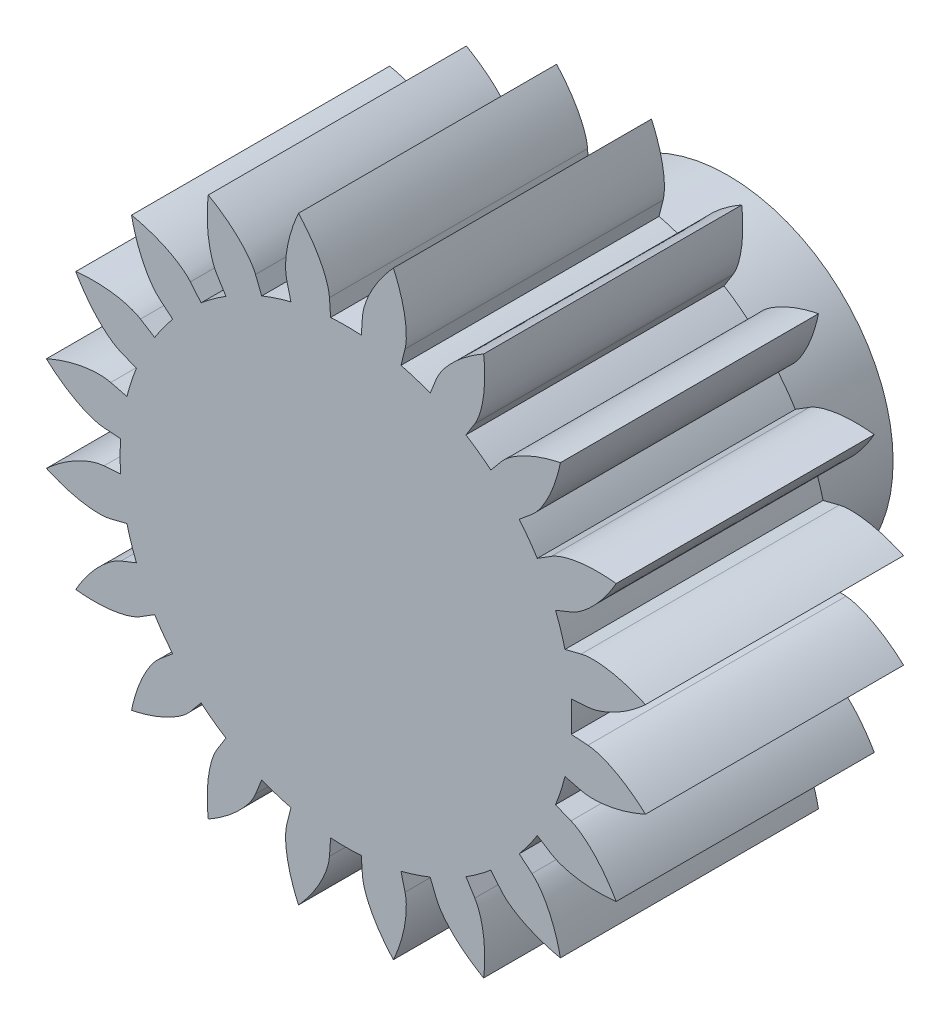
from build123d import *

# Parameters (mm, degrees)
SKETCH_1_R               = 5.5
SKETCH_1_R_2             = 1.475
EXTRUDE_1_DEPTH          = 5
EXTRUDE_START            = -5
SKETCH_6_R               = 6
SKETCH_6_R_2             = 5.5
EXTRUDE_4_DEPTH          = 5
CUT_EXTRUDE_1_DEPTH      = 10.848857802
PATTERN_CIRCULAR_1_COUNT = 20
PATTERN_CIRCULAR_1_ANGLE = 342
SKETCH_2_R               = 1.475
EXTRUDE_2_DEPTH          = 5
SKETCH_3_R               = 3.2
SKETCH_3_R_2             = 2.2
EXTRUDE_3_DEPTH          = 2.4
SKETCH_5_R               = 1.2
CUT_EXTRUDE_2_DEPTH      = 1


with BuildPart() as part:
    # 草图1 → 凸台-拉伸1 (new body)
    with BuildSketch(Plane.XY):
        Circle(SKETCH_1_R)
        Circle(SKETCH_1_R_2, mode=Mode.SUBTRACT)
    extrude(amount=EXTRUDE_1_DEPTH)

    # 草图6 → 凸台-拉伸4 (add)
    with BuildSketch(Plane.XY.offset(5).offset(EXTRUDE_START)):
        Circle(SKETCH_6_R)
        Circle(SKETCH_6_R_2, mode=Mode.SUBTRACT)
    extrude(amount=EXTRUDE_4_DEPTH)

    # 草图1<3> → 切除-拉伸1 (cut, through all)
    with BuildSketch(Plane.XY):
        with BuildLine():
            Line((4.68759624, 0.319369739), (4.364881259, 0.297382905))
            ThreePointArc((4.364881259, 0.297382905), (4.372469583, 0.148777503), (4.375, 0))
            ThreePointArc((4.375, 0), (4.372469583, -0.148777503), (4.364881259, -0.297382905))
            Line((4.364881259, -0.297382905), (4.68759624, -0.319369739))
            add(Edge.make_bspline(
                [(4.68759624, -0.319369739), (4.723328518, -0.321804208), (4.822539562, -0.336024472), (5.006239619, -0.392562489), (5.199142564, -0.482491423), (5.35109765, -0.572850293), (5.444197274, -0.635344688), (5.461765036, -0.647396861)],
                knots=[0, 0, 0, 0, 0, 0.005604068, 0.015718248, 0.029959916, 0.033300536, 0.033300536, 0.033300536, 0.033300536, 0.033300536], degree=4))
            ThreePointArc((5.461765036, -0.647396861), (5.490432938, -0.324262474), (5.5, 0))
            ThreePointArc((5.5, 0), (5.490432938, 0.324262474), (5.461765036, 0.647396861))
            add(Edge.make_bspline(
                [(4.68759624, 0.319369739), (4.723328518, 0.321804208), (4.822539562, 0.336024472), (5.006239619, 0.392562489), (5.199142564, 0.482491423), (5.35109765, 0.572850293), (5.444197274, 0.635344688), (5.461765036, 0.647396861)],
                knots=[0, 0, 0, 0, 0, 0.005604068, 0.015718248, 0.029959916, 0.033300536, 0.033300536, 0.033300536, 0.033300536, 0.033300536], degree=4))
        make_face()
        with BuildLine():
            add(Edge.make_bspline(
                [(5.461765036, 0.647396861), (5.542925307, 0.703075987), (5.660164645, 0.791829772), (5.771732758, 0.887518803), (5.877750133, 0.989088046), (5.912113353, 1.023188987)],
                knots=[0.033300536, 0.033300536, 0.033300536, 0.033300536, 0.033300536, 0.048733667, 0.056327564, 0.056327564, 0.056327564, 0.056327564, 0.056327564], degree=4))
            ThreePointArc((5.461765036, 0.647396861), (5.490432938, 0.324262474), (5.5, 0))
            ThreePointArc((5.5, 0), (5.490432938, -0.324262474), (5.461765036, -0.647396861))
            add(Edge.make_bspline(
                [(5.461765036, -0.647396861), (5.542925307, -0.703075987), (5.660164645, -0.791829772), (5.771732758, -0.887518803), (5.877750133, -0.989088046), (5.912113353, -1.023188987)],
                knots=[0.033300536, 0.033300536, 0.033300536, 0.033300536, 0.033300536, 0.048733667, 0.056327564, 0.056327564, 0.056327564, 0.056327564, 0.056327564], degree=4))
            ThreePointArc((5.912113353, -1.023188987), (5.977987961, -0.513478277), (6, 0))
            ThreePointArc((6, 0), (5.977987961, 0.513478277), (5.912113353, 1.023188987))
        make_face()
    cut_extrude_1 = extrude(amount=CUT_EXTRUDE_1_DEPTH, mode=Mode.SUBTRACT)

    # 阵列(圆周)1: 切除-拉伸1 ×20 about axis
    pattern_circular_1_axis = Axis((0, 0, 5), (0, 0, -1))
    for i in range(1, PATTERN_CIRCULAR_1_COUNT):
        add(cut_extrude_1.rotate(pattern_circular_1_axis, i * PATTERN_CIRCULAR_1_ANGLE / (PATTERN_CIRCULAR_1_COUNT - 1)), mode=Mode.SUBTRACT)

    # 草图2 → 凸台-拉伸2 (add, through all)
    with BuildSketch(Plane.XY.offset(5)):
        Circle(SKETCH_2_R)
    extrude(amount=-EXTRUDE_2_DEPTH)

    # 草图3 → 凸台-拉伸3 (add)
    # profile 1 of 2: a face of its own
    with BuildSketch(Plane(origin=(0, 0, 0), x_dir=(-1, 0, 0), z_dir=(0, 0, -1))):
        with Locations(Location((0, 0, 0), (0, 0, 180))):
            Circle(SKETCH_3_R)
        Circle(SKETCH_3_R_2, mode=Mode.SUBTRACT)
    # profile 2 of 2: a face of its own
    with BuildSketch(Plane(origin=(0, 0, 0), x_dir=(-1, 0, 0), z_dir=(0, 0, -1))):
        Polygon((0.6, -1.039230485), (1.2, 0), (0.6, 1.039230485), (-0.6, 1.039230485), (-1.2, 0), (-0.6, -1.039230485), align=None)
    extrude(amount=EXTRUDE_3_DEPTH)

    # 草图5 → 切除-拉伸2 (cut)
    with BuildSketch(Plane(origin=(0, 0, -2.4), x_dir=(-1, 0, 0), z_dir=(0, 0, -1))):
        Circle(SKETCH_5_R)
    extrude(amount=-CUT_EXTRUDE_2_DEPTH, mode=Mode.SUBTRACT)


solid = part.part
